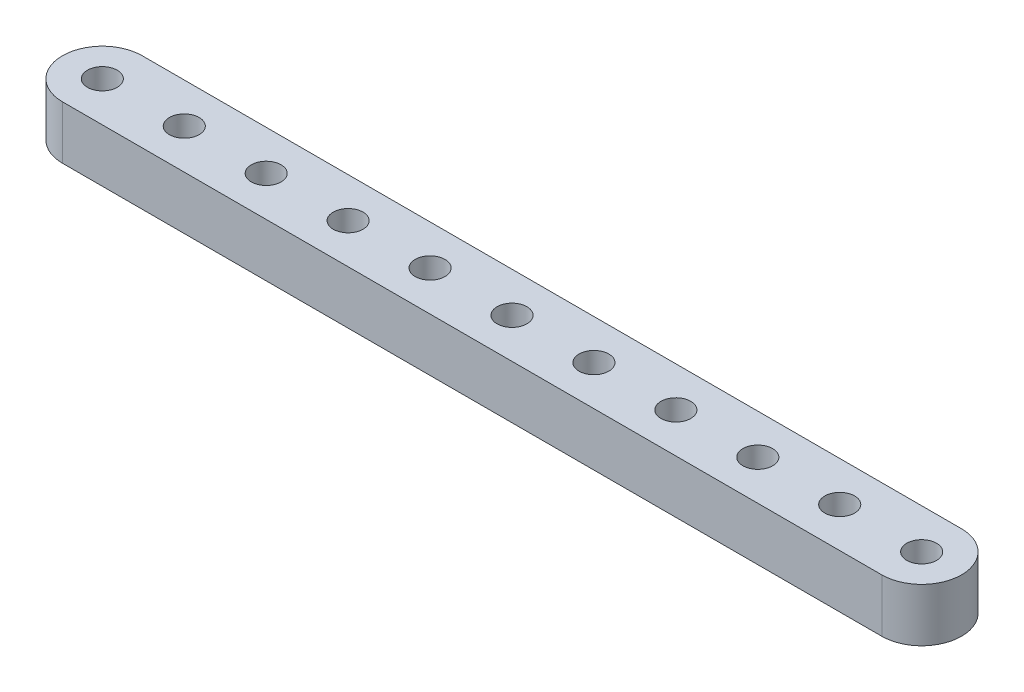
from build123d import *

# Parameters (mm, degrees)
SKETCH1_R           = 1.778
BOSS_EXTRUDE1_DEPTH = 6.35


with BuildPart() as part:
    # Sketch1 → Boss-Extrude1 (new body)
    with BuildSketch(Plane.XZ):
        with BuildLine():
            Line((-48.895, -4.7625), (48.895, -4.7625))
            ThreePointArc((48.895, -4.7625), (53.6575, 0), (48.895, 4.7625))
            Line((48.895, 4.7625), (-48.895, 4.7625))
            ThreePointArc((-48.895, 4.7625), (-53.6575, 0), (-48.895, -4.7625))
        make_face()
        with Locations(Location((48.895, 0, 0), (0, 0, 270))):
            Circle(SKETCH1_R, mode=Mode.SUBTRACT)
        with Locations(Location((39.116, 0, 0), (0, 0, 270))):
            Circle(SKETCH1_R, mode=Mode.SUBTRACT)
        with Locations(Location((29.337, 0, 0), (0, 0, 270))):
            Circle(SKETCH1_R, mode=Mode.SUBTRACT)
        with Locations(Location((19.558, 0, 0), (0, 0, 270))):
            Circle(SKETCH1_R, mode=Mode.SUBTRACT)
        with Locations(Location((9.779, 0, 0), (0, 0, 270))):
            Circle(SKETCH1_R, mode=Mode.SUBTRACT)
        with Locations(Location((0, 0, 0), (0, 0, 270))):
            Circle(SKETCH1_R, mode=Mode.SUBTRACT)
        with Locations(Location((-9.779, 0, 0), (0, 0, 270))):
            Circle(SKETCH1_R, mode=Mode.SUBTRACT)
        with Locations(Location((-19.558, 0, 0), (0, 0, 270))):
            Circle(SKETCH1_R, mode=Mode.SUBTRACT)
        with Locations(Location((-29.337, 0, 0), (0, 0, 270))):
            Circle(SKETCH1_R, mode=Mode.SUBTRACT)
        with Locations(Location((-39.116, 0, 0), (0, 0, 270))):
            Circle(SKETCH1_R, mode=Mode.SUBTRACT)
        with Locations(Location((-48.895, 0, 0), (0, 0, 270))):
            Circle(SKETCH1_R, mode=Mode.SUBTRACT)
    extrude(amount=-BOSS_EXTRUDE1_DEPTH)


solid = part.part
